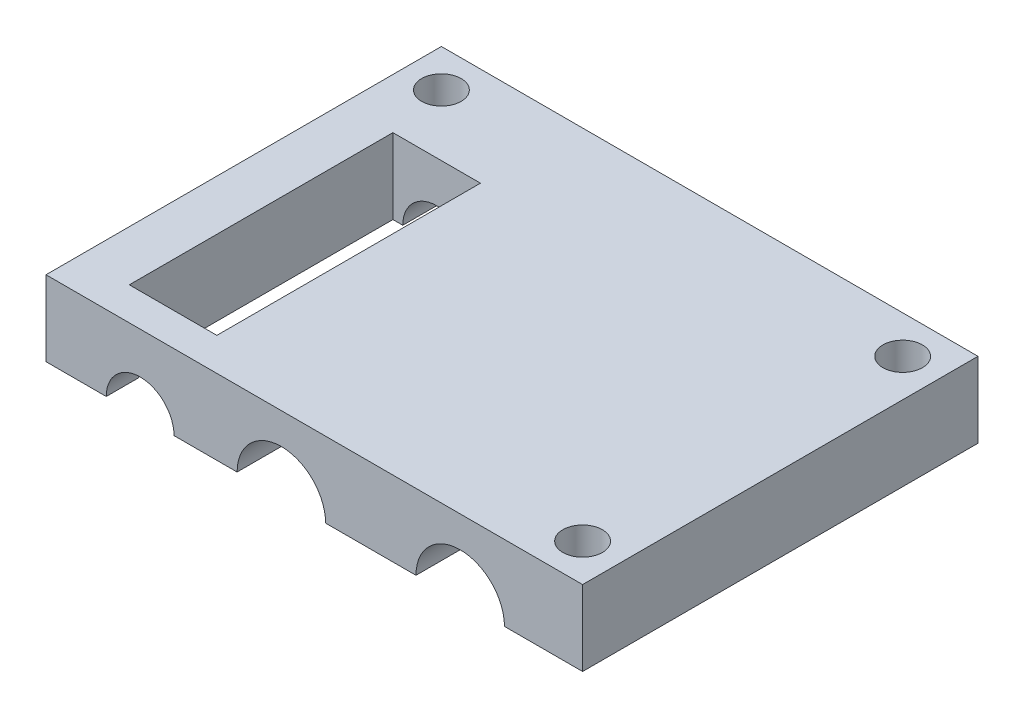
from build123d import *

# Parameters (mm, degrees)
SALIENTE_EXTRUIR1_DEPTH = 42
CROQUIS2_W              = 9.3
CROQUIS2_H              = 28
CORTAR_EXTRUIR1_DEPTH   = 50
CROQUIS3_R              = 2.1
CORTAR_EXTRUIR2_DEPTH   = 50
SALIENTE_EXTRUIR2_START = -3
SALIENTE_EXTRUIR2_DEPTH = 3


with BuildPart() as part:
    # Croquis1 → Saliente-Extruir1 (new body)
    with BuildSketch(Plane.XY):
        with BuildLine():
            Line((-28.5, 8), (-28.5, 0))
            Line((-28.5, 0), (-22.1, 0))
            ThreePointArc((-22.1, 0), (-18.5, 3.6), (-14.9, 0))
            Line((-14.9, 0), (-8.2, 0))
            ThreePointArc((-8.2, 0), (-3.5, 4.7), (1.2, 0))
            Line((1.2, 0), (10.8, 0))
            ThreePointArc((10.8, 0), (15.5, 4.7), (20.2, 0))
            Line((20.2, 0), (28.5, 0))
            Line((28.5, 0), (28.5, 8))
            Line((28.5, 8), (-28.5, 8))
        make_face()
    extrude(amount=-SALIENTE_EXTRUIR1_DEPTH)

    # Croquis2 → Cortar-Extruir1 (cut)
    with BuildSketch(Plane(origin=(0, 8, 0), x_dir=(1, 0, 0), z_dir=(0, 1, 0))):
        with Locations((-18.5, 17.5)):
            Rectangle(CROQUIS2_W, CROQUIS2_H)
    extrude(amount=-CORTAR_EXTRUIR1_DEPTH, mode=Mode.SUBTRACT)

    # Croquis3 → Cortar-Extruir2 (cut)
    with BuildSketch(Plane(origin=(0, 8, 0), x_dir=(1, 0, 0), z_dir=(0, 1, 0))):
        with Locations(Location((-24.5, 38, 0), (0, 0, 270))):
            Circle(CROQUIS3_R)
        with Locations(Location((24.5, 38, 0), (0, 0, 270))):
            Circle(CROQUIS3_R)
        with Locations(Location((24.5, 4, 0), (0, 0, 270))):
            Circle(CROQUIS3_R)
    extrude(amount=-CORTAR_EXTRUIR2_DEPTH, mode=Mode.SUBTRACT)

    # Croquis4 → Saliente-Extruir2 (add)
    with BuildSketch(Plane(origin=(0, 0, -42), x_dir=(-1, 0, 0), z_dir=(0, 0, -1)).offset(SALIENTE_EXTRUIR2_START)):
        with BuildLine():
            ThreePointArc((-10.8, 0), (-15.5, 4.7), (-20.2, 0))
            Line((-20.2, 0), (-17, 0))
            ThreePointArc((-17, 0), (-15.5, 1.5), (-14, 0))
            Line((-14, 0), (-10.8, 0))
        make_face()
        with BuildLine():
            ThreePointArc((8.2, 0), (3.5, 4.7), (-1.2, 0))
            Line((-1.2, 0), (2, 0))
            ThreePointArc((2, 0), (3.5, 1.5), (5, 0))
            Line((5, 0), (8.2, 0))
        make_face()
        with BuildLine():
            ThreePointArc((22.1, 0), (18.5, 3.6), (14.9, 0))
            Line((14.9, 0), (16.5, 0))
            ThreePointArc((16.5, 0), (18.5, 2), (20.5, 0))
            Line((20.5, 0), (22.1, 0))
        make_face()
    extrude(amount=SALIENTE_EXTRUIR2_DEPTH)


solid = part.part
